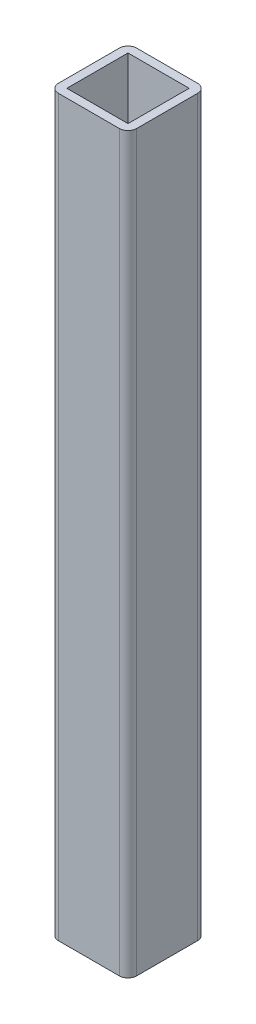
from build123d import *

# Parameters (mm, degrees)
BOSS_EXTRUDE1_DEPTH = 240
SKETCH3_W           = 20
SKETCH3_H           = 20
CUT_EXTRUDE1_DEPTH  = 1040.5


with BuildPart() as part:
    # Sketch1 → Boss-Extrude1 (new body)
    with BuildSketch(Plane(origin=(0, 0, 0), x_dir=(1, 0, 0), z_dir=(0, 1, 0))):
        with BuildLine():
            Line((2.8, 0), (22.8, 0))
            ThreePointArc((22.8, 0), (24.779898987, -0.820101013), (25.6, -2.8))
            Line((25.6, -2.8), (25.6, -22.8))
            ThreePointArc((25.6, -22.8), (24.779898987, -24.779898987), (22.8, -25.6))
            Line((22.8, -25.6), (2.8, -25.6))
            ThreePointArc((2.8, -25.6), (0.820101013, -24.779898987), (0, -22.8))
            Line((0, -22.8), (0, -2.8))
            ThreePointArc((0, -2.8), (0.820101013, -0.820101013), (2.8, 0))
        make_face()
    extrude(amount=BOSS_EXTRUDE1_DEPTH)

    # Sketch3 → Cut-Extrude1 (cut)
    with BuildSketch(Plane(origin=(0, 0, 0), x_dir=(-1, 0, 0), z_dir=(0, -1, 0))):
        with Locations((-12.8, -12.8)):
            Rectangle(SKETCH3_W, SKETCH3_H)
    extrude(amount=-CUT_EXTRUDE1_DEPTH, mode=Mode.SUBTRACT)


solid = part.part
